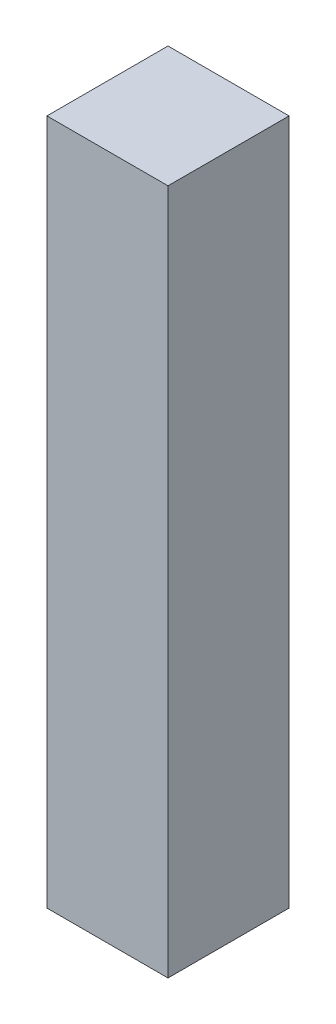
from build123d import *

# Parameters (mm, degrees)
SKETCH1_W           = 300
SKETCH1_H           = 300
BOSS_EXTRUDE1_DEPTH = 1700


with BuildPart() as part:
    # Sketch1 → Boss-Extrude1 (new body)
    with BuildSketch(Plane(origin=(0, 0, 0), x_dir=(1, 0, 0), z_dir=(0, 1, 0))):
        Rectangle(SKETCH1_W, SKETCH1_H)
    extrude(amount=BOSS_EXTRUDE1_DEPTH)


solid = part.part
